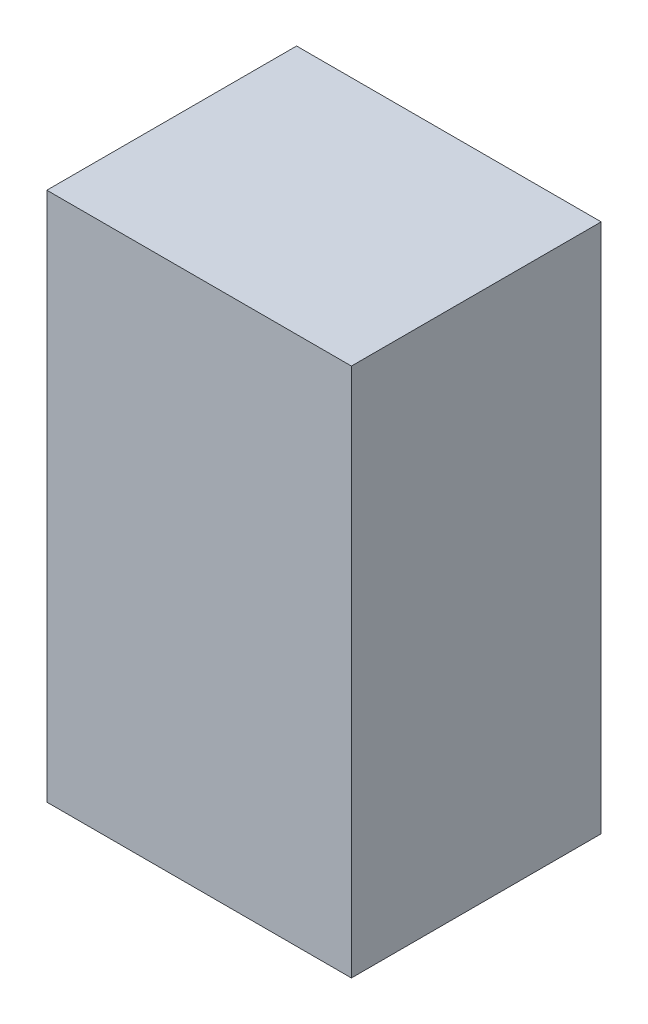
from build123d import *

# Parameters (mm, degrees)
SKETCH1_W           = 50
SKETCH1_H           = 87
BOSS_EXTRUDE1_DEPTH = 41


with BuildPart() as part:
    # Sketch1 → Boss-Extrude1 (new body)
    with BuildSketch(Plane.XY):
        Rectangle(SKETCH1_W, SKETCH1_H)
    extrude(amount=BOSS_EXTRUDE1_DEPTH)


solid = part.part
